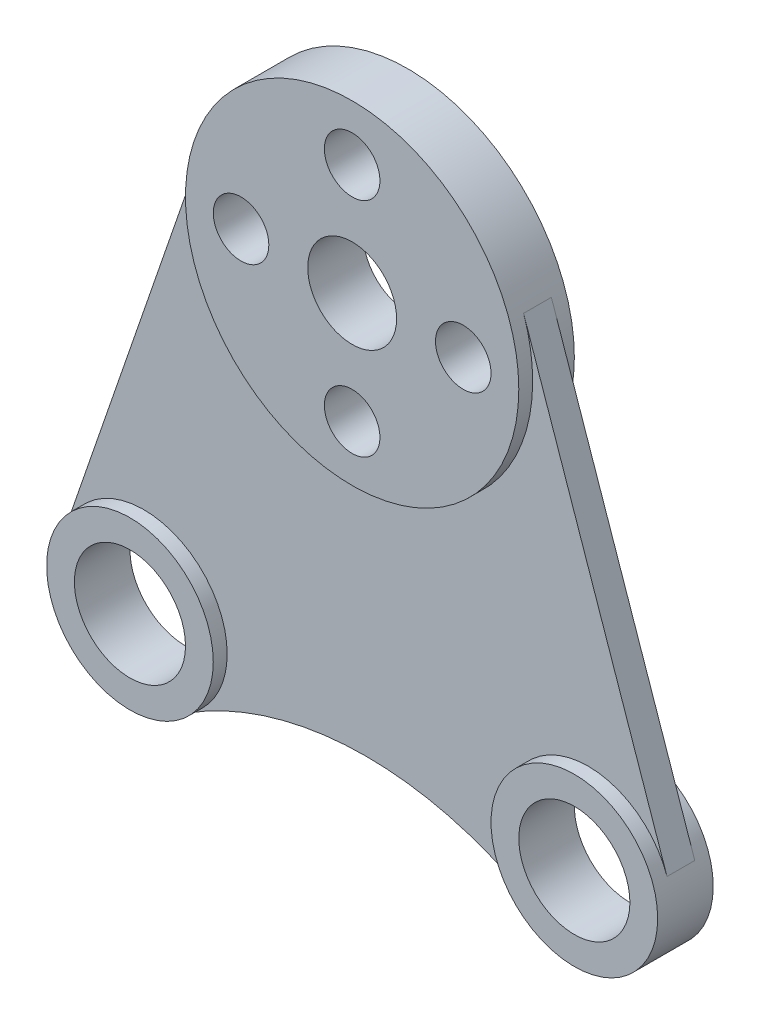
from build123d import *

# Parameters (mm, degrees)
SKETCH1_R             = 15
SKETCH1_R_2           = 10
BOSS_EXTRUDE1_DEPTH   = 5
SKETCH1_R_3           = 30
SKETCH1_R_4           = 5
SKETCH1_R_5           = 8
BOSS_EXTRUDE1_2_DEPTH = 5
BOSS_EXTRUDE1_3_DEPTH = 5
BOSS_EXTRUDE2_DEPTH   = 2.5


with BuildPart() as part:
    # Sketch1 → Boss-Extrude1 (new, symmetric)
    with BuildSketch(Plane.XY):
        with Locations((-40, -70)):
            Circle(SKETCH1_R)
        with Locations((-40, -70)):
            Circle(SKETCH1_R_2, mode=Mode.SUBTRACT)
    extrude(amount=BOSS_EXTRUDE1_DEPTH, both=True)



with BuildPart() as body_2:
    # Sketch1 → Boss-Extrude1 2 (new, symmetric)
    with BuildSketch(Plane.XY):
        Circle(SKETCH1_R_3)
        with Locations((-20, 0)):
            Circle(SKETCH1_R_4, mode=Mode.SUBTRACT)
        with Locations((0, -20)):
            Circle(SKETCH1_R_4, mode=Mode.SUBTRACT)
        Circle(SKETCH1_R_5, mode=Mode.SUBTRACT)
        with Locations((20, 0)):
            Circle(SKETCH1_R_4, mode=Mode.SUBTRACT)
        with Locations((0, 20)):
            Circle(SKETCH1_R_4, mode=Mode.SUBTRACT)
    extrude(amount=BOSS_EXTRUDE1_2_DEPTH, both=True)


with BuildPart() as body_3:
    # Sketch1 → Boss-Extrude1 3 (new, symmetric)
    with BuildSketch(Plane.XY):
        with Locations((40, -70)):
            Circle(SKETCH1_R)
        with Locations((40, -70)):
            Circle(SKETCH1_R_2, mode=Mode.SUBTRACT)
    extrude(amount=BOSS_EXTRUDE1_3_DEPTH, both=True)


with BuildPart() as part_1:
    add(part.part)

    add(body_2.part)  # Boss-Extrude2 merges body 2

    add(body_3.part)  # Boss-Extrude2 merges body 3
    # Sketch1<3> → Boss-Extrude2 (add, symmetric)
    with BuildSketch(Plane.XY):
        with BuildLine():
            Line((-28.361736144, 9.778134939), (-54.180868072, -65.11093253))
            ThreePointArc((-54.180868072, -65.11093253), (-37.521393646, -55.206200267), (-25, -70))
            ThreePointArc((-25, -70), (-26.866074463, -77.245688373), (-32, -82.68857754))
            ThreePointArc((-32, -82.68857754), (0, -73.442887702), (32, -82.68857754))
            ThreePointArc((32, -82.68857754), (30.683660399, -58.24390301), (54.180868072, -65.11093253))
            Line((54.180868072, -65.11093253), (28.361736144, 9.778134939))
            ThreePointArc((28.361736144, 9.778134939), (29.587599466, 4.957212709), (30, 0))
            ThreePointArc((30, 0), (-4.957212709, -29.587599466), (-28.361736144, 9.778134939))
        make_face()
    extrude(amount=BOSS_EXTRUDE2_DEPTH, both=True)


solid = part_1.part
